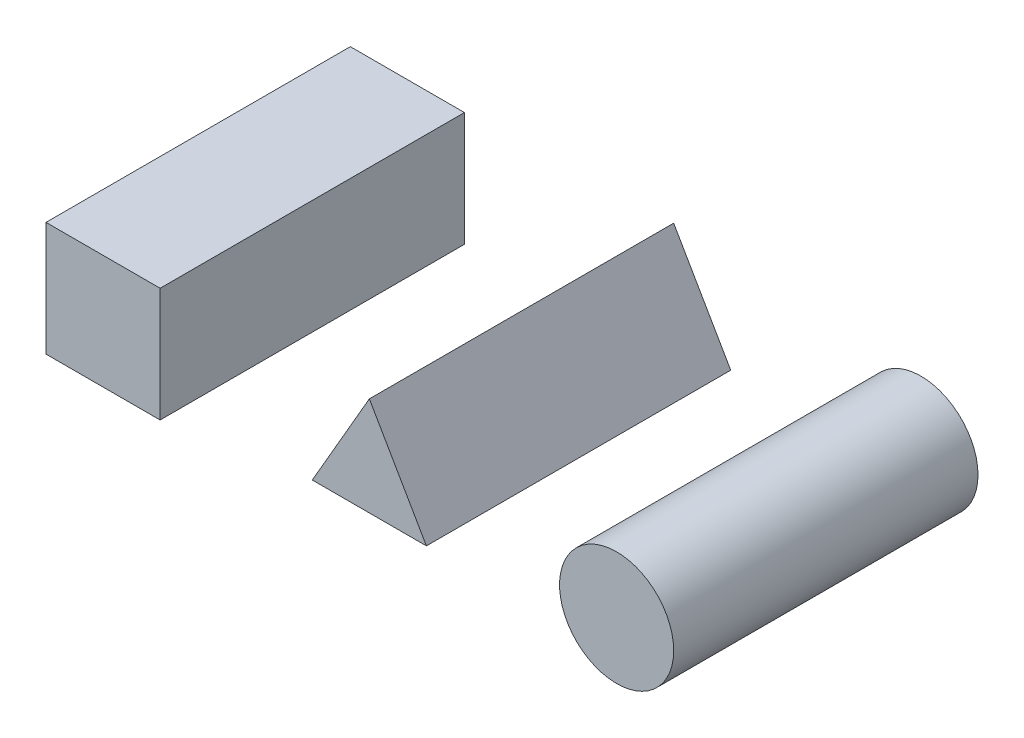
from build123d import *

# Parameters (mm, degrees)
SKETCH1_R             = 15
BOSS_EXTRUDE1_DEPTH   = 80
BOSS_EXTRUDE1_2_DEPTH = 80
SKETCH1_W             = 30
SKETCH1_H             = 30
BOSS_EXTRUDE1_3_DEPTH = 80


with BuildPart() as part:
    # Sketch1 → Boss-Extrude1 (new body)
    with BuildSketch(Plane.XY):
        with Locations((65, 0)):
            Circle(SKETCH1_R)
    extrude(amount=BOSS_EXTRUDE1_DEPTH)


with BuildPart() as body_2:
    # Sketch1 → Boss-Extrude1 2 (new body)
    with BuildSketch(Plane.XY):
        Polygon((-15, -8.660254038), (0, 17.320508076), (15, -8.660254038), align=None)
    extrude(amount=BOSS_EXTRUDE1_2_DEPTH)


with BuildPart() as body_3:
    # Sketch1 → Boss-Extrude1 3 (new body)
    with BuildSketch(Plane.XY):
        with Locations((-70, 0)):
            Rectangle(SKETCH1_W, SKETCH1_H)
    extrude(amount=BOSS_EXTRUDE1_3_DEPTH)


solid = Compound([part.part, body_2.part, body_3.part])
